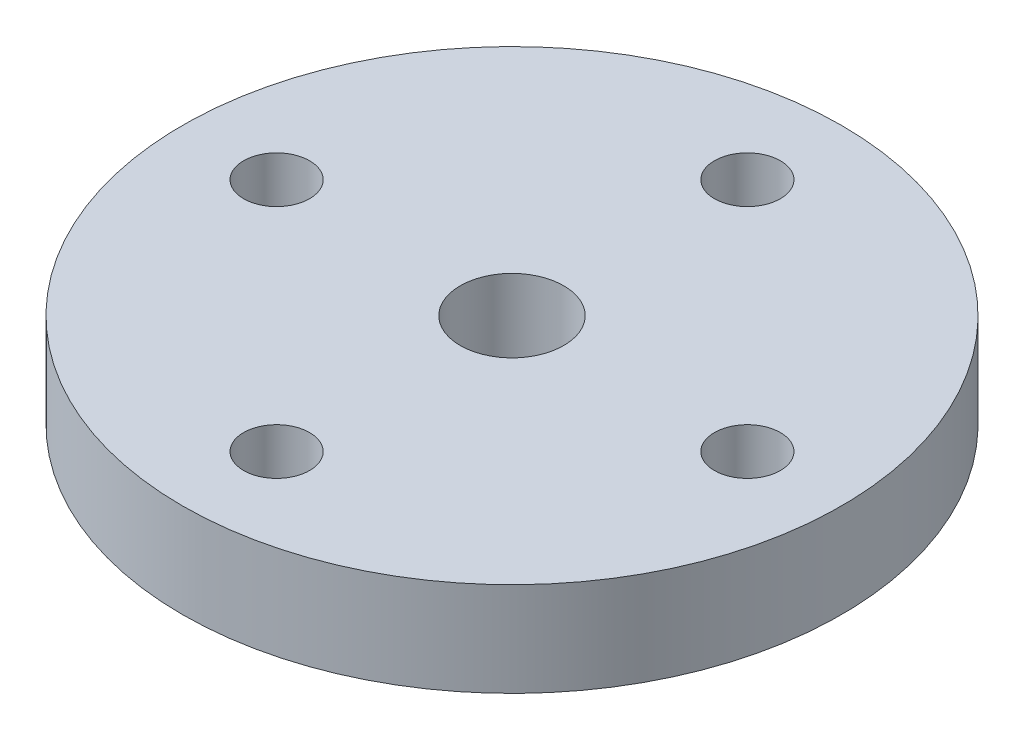
from build123d import *

# Parameters (mm, degrees)
SKETCH1_R           = 10.5
SKETCH1_R_2         = 1.65
SKETCH1_R_3         = 1.05
BOSS_EXTRUDE1_DEPTH = 3


with BuildPart() as part:
    # Sketch1 → Boss-Extrude1 (new body)
    with BuildSketch(Plane(origin=(0, 0, 0), x_dir=(1, 0, 0), z_dir=(0, 1, 0))):
        with Locations(Location((0, 0, 0), (0, 0, 270))):
            Circle(SKETCH1_R)
        with Locations(Location((0, 0, 0), (0, 0, 270))):
            Circle(SKETCH1_R_2, mode=Mode.SUBTRACT)
        with Locations(Location((-7.5, 0, 0), (0, 0, 270))):
            Circle(SKETCH1_R_3, mode=Mode.SUBTRACT)
        with Locations(Location((0, 7.5, 0), (0, 0, 270))):
            Circle(SKETCH1_R_3, mode=Mode.SUBTRACT)
        with Locations(Location((7.5, 0, 0), (0, 0, 270))):
            Circle(SKETCH1_R_3, mode=Mode.SUBTRACT)
        with Locations(Location((0, -7.5, 0), (0, 0, 270))):
            Circle(SKETCH1_R_3, mode=Mode.SUBTRACT)
    extrude(amount=BOSS_EXTRUDE1_DEPTH)


solid = part.part
